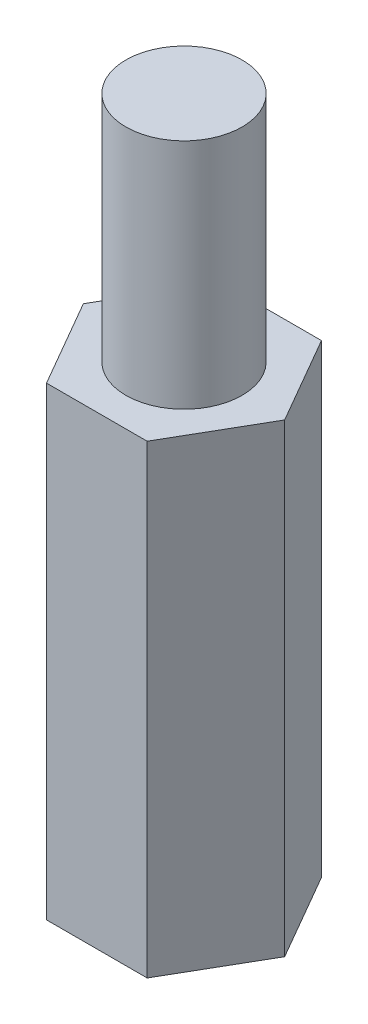
from build123d import *

# Parameters (mm, degrees)
SKETCH1_R           = 1.5
BOSS_EXTRUDE1_DEPTH = 12
BOSS_EXTRUDE2_DEPTH = 3
SKETCH3_R           = 1.5
BOSS_EXTRUDE3_DEPTH = 6


with BuildPart() as part:
    # Sketch1 → Boss-Extrude1 (new body)
    with BuildSketch(Plane(origin=(0, 0, 0), x_dir=(1, 0, 0), z_dir=(0, 1, 0))):
        Polygon((2.598076211, 0), (1.299038106, 2.25), (-1.299038106, 2.25), (-2.598076211, 0), (-1.299038106, -2.25), (1.299038106, -2.25), align=None)
        with Locations(Location((0, 0, 0), (0, 0, 270))):
            Circle(SKETCH1_R, mode=Mode.SUBTRACT)
    extrude(amount=BOSS_EXTRUDE1_DEPTH)

    # Sketch2 → Boss-Extrude2 (add)
    with BuildSketch(Plane(origin=(0, 12, 0), x_dir=(1, 0, 0), z_dir=(0, 1, 0))):
        Polygon((2.598076211, 0), (1.299038106, 2.25), (-1.299038106, 2.25), (-2.598076211, 0), (-1.299038106, -2.25), (1.299038106, -2.25), align=None)
    extrude(amount=-BOSS_EXTRUDE2_DEPTH)

    # Sketch3 → Boss-Extrude3 (add)
    with BuildSketch(Plane(origin=(0, 12, 0), x_dir=(1, 0, 0), z_dir=(0, 1, 0))):
        with Locations(Location((0, 0, 0), (0, 0, 270))):
            Circle(SKETCH3_R)
    extrude(amount=BOSS_EXTRUDE3_DEPTH)


solid = part.part
